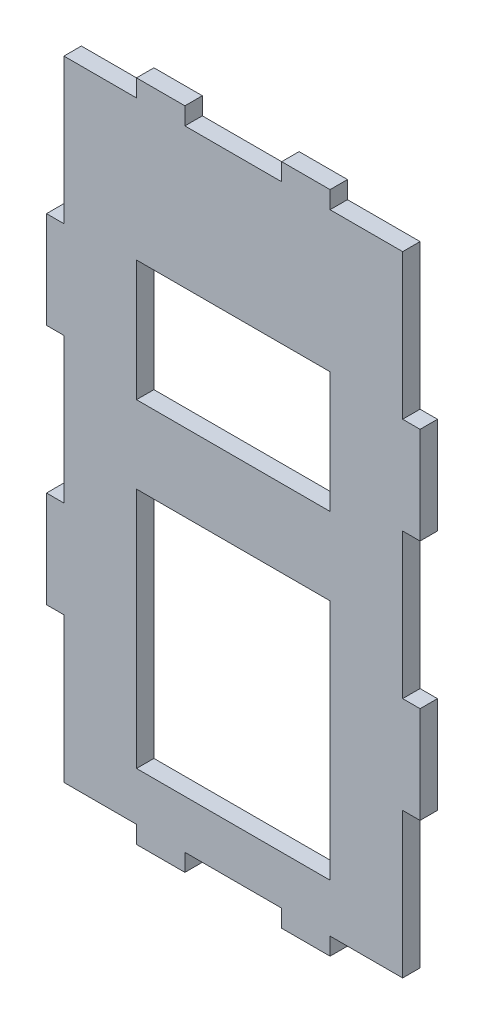
from build123d import *

# Parameters (mm, degrees)
SKETCH1_W           = 98.044
SKETCH1_H           = 174.244
BOSS_EXTRUDE1_DEPTH = 4.572
SKETCH2_W           = 23.622
SKETCH2_H           = 4.572
SKETCH2_W_2         = 25.4
CUT_EXTRUDE1_DEPTH  = 4.572
SKETCH3_W           = 4.572
SKETCH3_H           = 38.1
CUT_EXTRUDE2_DEPTH  = 4.572
SKETCH4_W           = 50.8
SKETCH4_H           = 63.5
SKETCH4_H_2         = 31.75
CUT_EXTRUDE3_DEPTH  = 4.572


with BuildPart() as part:
    # Sketch1 → Boss-Extrude1 (new body)
    with BuildSketch(Plane.XY):
        with Locations((49.022, 87.122)):
            Rectangle(SKETCH1_W, SKETCH1_H)
    extrude(amount=BOSS_EXTRUDE1_DEPTH)

    # Sketch2 → Cut-Extrude1 (cut)
    with BuildSketch(Plane.XY.offset(4.572)):
        with Locations((11.811, 2.286)):
            Rectangle(SKETCH2_W, SKETCH2_H)
        with Locations((49.022, 2.286)):
            Rectangle(SKETCH2_W_2, SKETCH2_H)
        with Locations((86.233, 2.286)):
            Rectangle(SKETCH2_W, SKETCH2_H)
        with Locations((11.811, 171.958)):
            Rectangle(SKETCH2_W, SKETCH2_H)
        with Locations((49.022, 171.958)):
            Rectangle(SKETCH2_W_2, SKETCH2_H)
        with Locations((86.233, 171.958)):
            Rectangle(SKETCH2_W, SKETCH2_H)
    extrude(amount=-CUT_EXTRUDE1_DEPTH, mode=Mode.SUBTRACT)

    # Sketch3 → Cut-Extrude2 (cut)
    with BuildSketch(Plane.XY.offset(4.572)):
        with Locations((2.286, 23.622)):
            Rectangle(SKETCH3_W, SKETCH3_H)
        with Locations((95.758, 23.622)):
            Rectangle(SKETCH3_W, SKETCH3_H)
        with Locations((2.286, 87.122)):
            Rectangle(SKETCH3_W, SKETCH3_H)
        with Locations((2.286, 150.622)):
            Rectangle(SKETCH3_W, SKETCH3_H)
        with Locations((95.758, 150.622)):
            Rectangle(SKETCH3_W, SKETCH3_H)
        with Locations((95.758, 87.122)):
            Rectangle(SKETCH3_W, SKETCH3_H)
    extrude(amount=-CUT_EXTRUDE2_DEPTH, mode=Mode.SUBTRACT)

    # Sketch4 → Cut-Extrude3 (cut)
    with BuildSketch(Plane.XY.offset(4.572)):
        with Locations((49.022, 49.022)):
            Rectangle(SKETCH4_W, SKETCH4_H)
        with Locations((49.022, 116.967)):
            Rectangle(SKETCH4_W, SKETCH4_H_2)
    extrude(amount=-CUT_EXTRUDE3_DEPTH, mode=Mode.SUBTRACT)


solid = part.part
